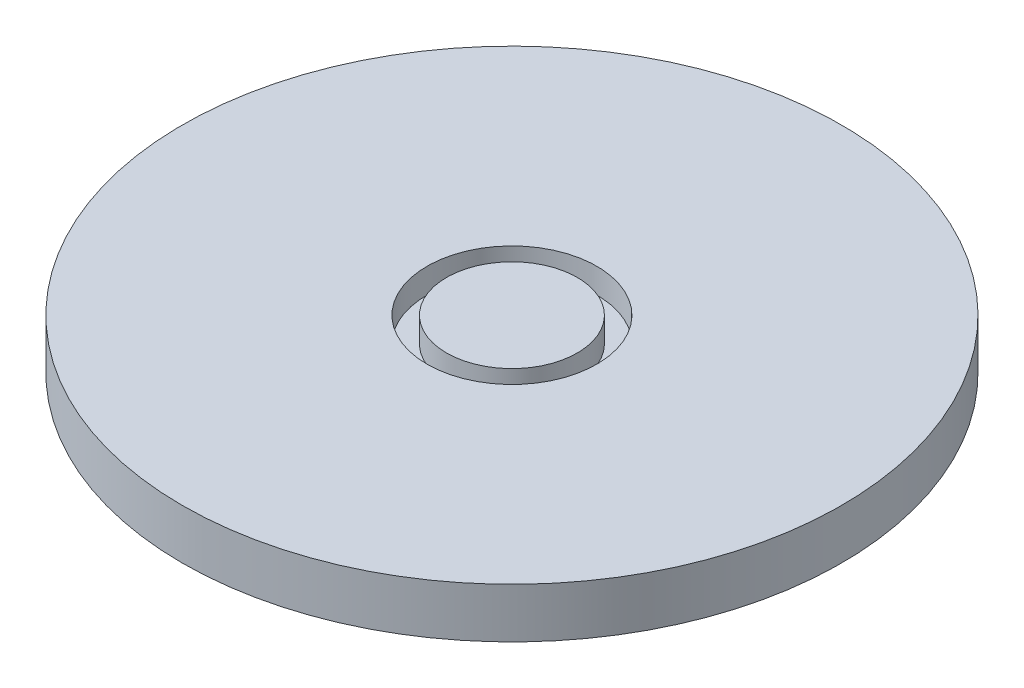
from build123d import *

# Parameters (mm, degrees)
BOSS_EXTRUDE1_DEPTH      = 2.5
BOSS_EXTRUDE1_DEPTH_BACK = 2.5
SKETCH1_R                = 33
SKETCH1_R_2              = 8.5
BOSS_EXTRUDE2_DEPTH      = 2.5
BOSS_EXTRUDE3_DEPTH      = 2.5
BOSS_EXTRUDE3_DEPTH_BACK = 15
SKETCH1_5_R              = 6.55
SKETCH1_6_R              = 8.5
SKETCH1_6_R_2            = 6.55
BOSS_EXTRUDE4_DEPTH      = 5
BOSS_EXTRUDE5_START      = -6.9
SKETCH2_R                = 8.5
SKETCH2_R_2              = 2.55
BOSS_EXTRUDE5_DEPTH      = 6.9
FILLET1_R                = 2
BOSS_EXTRUDE6_DEPTH      = 3.01


with BuildPart() as part:
    # Sketch1 → Boss-Extrude1 (new, two sides: drawn at the far end of the back side and taken through both)
    with BuildSketch(Plane(origin=(0, 0, 0), x_dir=(1, 0, 0), z_dir=(0, 1, 0)).offset(-BOSS_EXTRUDE1_DEPTH_BACK)):
        with Locations(Location((0, 0, 0), (0, 0, 270))):
            Circle(SKETCH1_R)
        with Locations(Location((0, 0, 0), (0, 0, 270))):
            Circle(SKETCH1_R_2, mode=Mode.SUBTRACT)
    extrude(amount=BOSS_EXTRUDE1_DEPTH + BOSS_EXTRUDE1_DEPTH_BACK)



with BuildPart() as body_2:
    # Sketch1<4> → Boss-Extrude2 (new body)
    with BuildSketch(Plane(origin=(0, 0, 0), x_dir=(1, 0, 0), z_dir=(0, 1, 0))):
        with BuildLine():
            ThreePointArc((-1.53, 2.04), (-2.41914241, -0.806380803), (0, -2.55))
            Line((0, -2.55), (0, 2.04))
            Line((0, 2.04), (-1.53, 2.04))
        make_face()
        with BuildLine():
            Line((0, 2.04), (0, -2.55))
            ThreePointArc((0, -2.55), (1.803122292, -1.803122292), (2.55, 0))
            ThreePointArc((2.55, 0), (2.280789337, 1.140394669), (1.53, 2.04))
            Line((1.53, 2.04), (0, 2.04))
        make_face()
    extrude(amount=BOSS_EXTRUDE2_DEPTH)

    # Sketch1<5> → Boss-Extrude3 (add, two sides: drawn at the far end of the back side and taken through both)
    with BuildSketch(Plane(origin=(0, 0, 0), x_dir=(1, 0, 0), z_dir=(0, 1, 0)).offset(-BOSS_EXTRUDE3_DEPTH_BACK)):
        with Locations(Location((0, 0, 0), (0, 0, 270))):
            Circle(SKETCH1_5_R)
        with BuildLine():
            Line((-1.53, 2.04), (1.53, 2.04))
            ThreePointArc((1.53, 2.04), (0, -2.55), (-1.53, 2.04))
        make_face(mode=Mode.SUBTRACT)
    extrude(amount=BOSS_EXTRUDE3_DEPTH + BOSS_EXTRUDE3_DEPTH_BACK)


with BuildPart() as part_1:
    add(part.part)

    add(body_2.part)  # Boss-Extrude4 merges body 2
    # Sketch1<6> → Boss-Extrude4 (add)
    with BuildSketch(Plane(origin=(0, 0, 0), x_dir=(1, 0, 0), z_dir=(0, 1, 0))):
        with Locations(Location((0, 0, 0), (0, 0, 270))):
            Circle(SKETCH1_6_R)
        with Locations(Location((0, 0, 0), (0, 0, 270))):
            Circle(SKETCH1_6_R_2, mode=Mode.SUBTRACT)
    extrude(amount=-BOSS_EXTRUDE4_DEPTH)

    # Sketch2 → Boss-Extrude5 (add)
    with BuildSketch(Plane(origin=(0, -8.1, 0), x_dir=(1, 0, 0), z_dir=(0, 1, 0)).offset(BOSS_EXTRUDE5_START)):
        with Locations(Location((0, 0, 0), (0, 0, 270))):
            Circle(SKETCH2_R)
        Circle(SKETCH2_R_2, mode=Mode.SUBTRACT)
    extrude(amount=BOSS_EXTRUDE5_DEPTH)

    # Fillet1
    fillet1_edges = [part_1.edges().sort_by_distance(p)[0] for p in [
        (0, -2.5, -8.5),
    ]]
    fillet(fillet1_edges, radius=FILLET1_R)

    # Sketch3 → Boss-Extrude6 (add)
    with BuildSketch(Plane(origin=(0, -8.1, 0), x_dir=(1, 0, 0), z_dir=(0, 1, 0))):
        with BuildLine():
            ThreePointArc((6.489574687, 0.887648796), (6.55, 0), (6.489574687, -0.887648796))
            add(Edge.make_bspline(
                [(6.489574687, -0.887648796), (7.8, -0.48452531), (7.8, 0)],
                knots=[5.695086191, 5.695086191, 5.695086191, 6.283185307, 6.283185307, 6.283185307], degree=2, weights=[1, 0.957078041, 1]))
            add(Edge.make_bspline(
                [(7.8, 0), (7.8, 0.48452531), (6.489574687, 0.887648796)],
                knots=[0, 0, 0, 0.588099116, 0.588099116, 0.588099116], degree=2, weights=[1, 0.957078041, 1]))
        make_face()
        with BuildLine():
            ThreePointArc((3.961159785, 5.216484751), (4.631549417, 4.631549417), (5.216484751, 3.961159785))
            add(Edge.make_bspline(
                [(5.216484751, 3.961159785), (5.858044026, 5.172821761), (5.515432893, 5.515432893)],
                knots=[5.695086191, 5.695086191, 5.695086191, 6.283185307, 6.283185307, 6.283185307], degree=2, weights=[1, 0.957078041, 1]))
            add(Edge.make_bspline(
                [(5.515432893, 5.515432893), (5.172821761, 5.858044026), (3.961159785, 5.216484751)],
                knots=[0, 0, 0, 0.588099116, 0.588099116, 0.588099116], degree=2, weights=[1, 0.957078041, 1]))
        make_face()
        with BuildLine():
            add(Edge.make_bspline(
                [(3.972298874, -5.208007456), (6.522331769, -6.529808173), (5.201644202, -3.98062779)],
                knots=[2.567584119, 2.567584119, 2.567584119, 3.715272936, 3.715272936, 3.715272936], degree=2, weights=[1, 0.839820193, 1]))
            ThreePointArc((5.201644202, -3.98062779), (4.627842164, -4.635253704), (3.972298874, -5.208007456))
        make_face()
        with BuildLine():
            ThreePointArc((-0.911324659, 6.486292267), (-0.00524075, 6.549997903), (0.900943942, 6.487742289))
            add(Edge.make_bspline(
                [(0.900943942, 6.487742289), (0.491618387, 7.85844559), (-0.004973928, 7.85844559)],
                knots=[5.681298558, 5.681298558, 5.681298558, 6.283185307, 6.283185307, 6.283185307], degree=2, weights=[1, 0.955057278, 1]))
            add(Edge.make_bspline(
                [(-0.004973928, 7.85844559), (-0.501854156, 7.85844559), (-0.911324659, 6.486292267)],
                knots=[0, 0, 0, 0.602215002, 0.602215002, 0.602215002], degree=2, weights=[1, 0.955008614, 1]))
        make_face()
        with BuildLine():
            add(Edge.make_bspline(
                [(-0.873777918, -6.491456859), (-0.005286616, -9.229256662), (0.863388985, -6.492846792)],
                knots=[2.567584119, 2.567584119, 2.567584119, 3.715272936, 3.715272936, 3.715272936], degree=2, weights=[1, 0.839820193, 1]))
            ThreePointArc((0.863388985, -6.492846792), (-0.00524075, -6.549997903), (-0.873777918, -6.491456859))
        make_face()
        with BuildLine():
            ThreePointArc((-5.230905092, 3.9420974), (-4.635253704, 4.627842164), (-3.950462996, 5.224590138))
            add(Edge.make_bspline(
                [(-3.950462996, 5.224590138), (-5.209133471, 5.904386861), (-5.560277264, 5.553243068)],
                knots=[5.681298558, 5.681298558, 5.681298558, 6.283185307, 6.283185307, 6.283185307], degree=2, weights=[1, 0.955057278, 1]))
            add(Edge.make_bspline(
                [(-5.560277264, 5.553243068), (-5.911624643, 5.201895689), (-5.230905092, 3.9420974)],
                knots=[0, 0, 0, 0.602215002, 0.602215002, 0.602215002], degree=2, weights=[1, 0.955008614, 1]))
        make_face()
        with BuildLine():
            add(Edge.make_bspline(
                [(-5.216484751, -3.961159785), (-6.629151931, -6.629151931), (-3.961159785, -5.216484751)],
                knots=[2.553493537, 2.553493537, 2.553493537, 3.72969177, 3.72969177, 3.72969177], degree=2, weights=[1, 0.831996755, 1]))
            ThreePointArc((-3.961159785, -5.216484751), (-4.631549417, -4.631549417), (-5.216484751, -3.961159785))
        make_face()
        with BuildLine():
            ThreePointArc((-6.489574687, -0.887648796), (-6.55, 0), (-6.489574687, 0.887648796))
            add(Edge.make_bspline(
                [(-6.489574687, 0.887648796), (-9.375036568, 0), (-6.489574687, -0.887648796)],
                knots=[2.553493537, 2.553493537, 2.553493537, 3.72969177, 3.72969177, 3.72969177], degree=2, weights=[1, 0.831996755, 1]))
        make_face()
    extrude(amount=BOSS_EXTRUDE6_DEPTH)


solid = part_1.part
